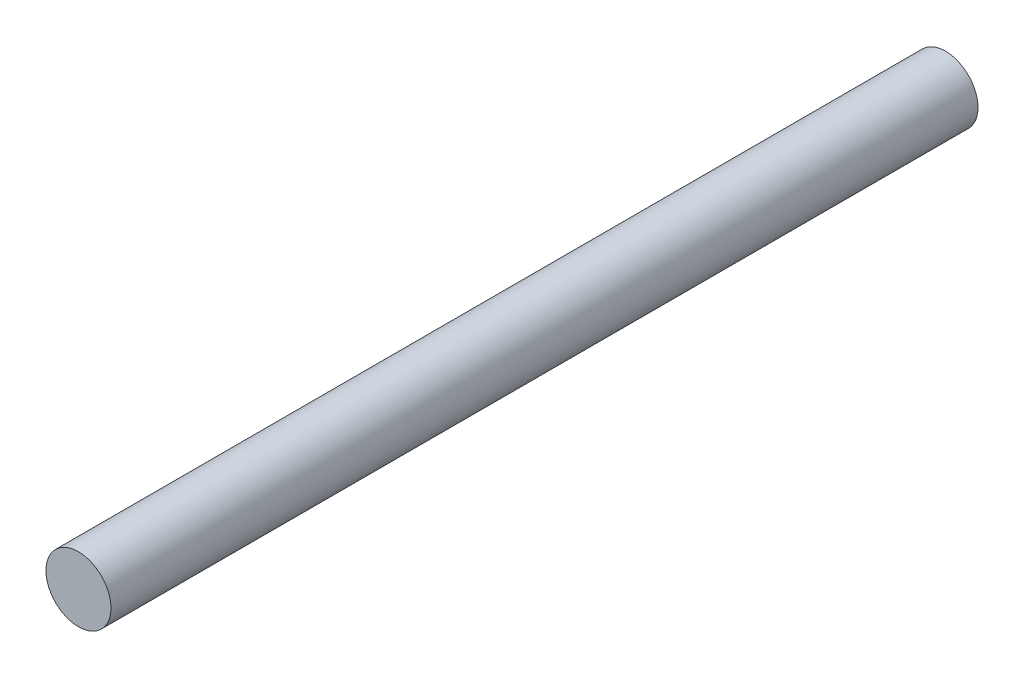
from build123d import *

# Parameters (mm, degrees)
SKETCH1_R           = 3.75
BOSS_EXTRUDE1_DEPTH = 100


with BuildPart() as part:
    # Sketch1 → Boss-Extrude1 (new body)
    with BuildSketch(Plane.XY):
        Circle(SKETCH1_R)
    extrude(amount=BOSS_EXTRUDE1_DEPTH)


solid = part.part
